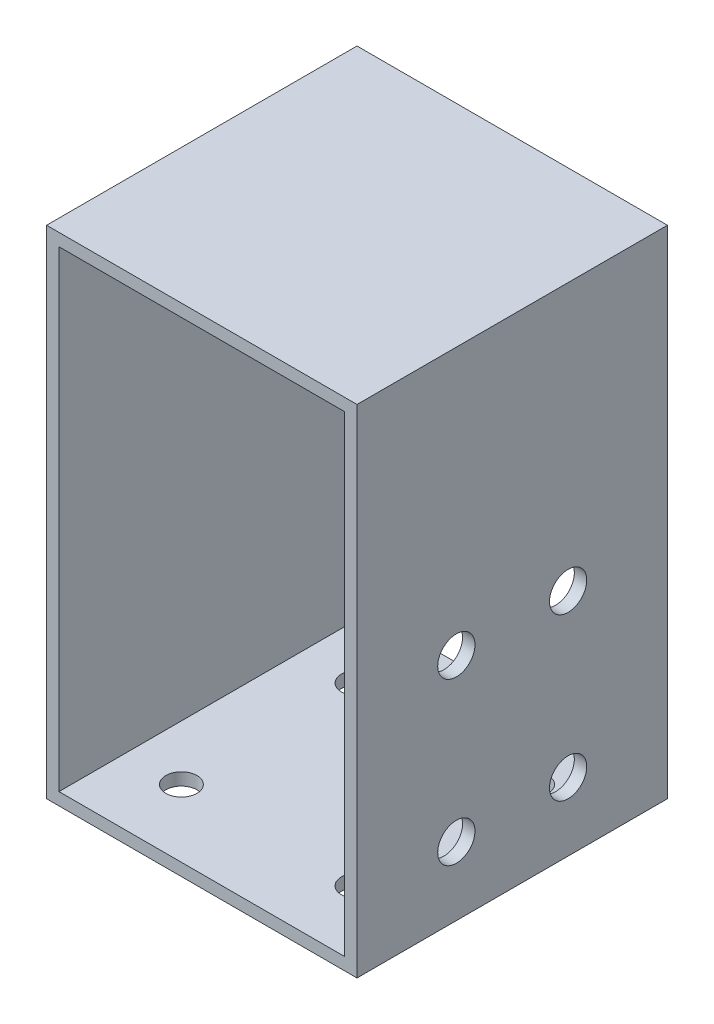
from build123d import *

# Parameters (mm, degrees)
SKETCH_1_W          = 25
SKETCH_1_H          = 40
SKETCH_1_W_2        = 23
SKETCH_1_H_2        = 38
EXTRUDE_1_DEPTH     = 12.5
SKETCH_2_R          = 1.25
CUT_EXTRUDE_1_DEPTH = 10
SKETCH_3_R          = 1.5
CUT_EXTRUDE_2_DEPTH = 10


with BuildPart() as part:
    # 草图1 → 凸台-拉伸1 (new, symmetric)
    with BuildSketch(Plane.XY):
        Rectangle(SKETCH_1_W, SKETCH_1_H)
        Rectangle(SKETCH_1_W_2, SKETCH_1_H_2, mode=Mode.SUBTRACT)
    extrude(amount=EXTRUDE_1_DEPTH, both=True)

    # 草图2 → 切除-拉伸1 (cut)
    with BuildSketch(Plane(origin=(0, -19, 0), x_dir=(1, 0, 0), z_dir=(0, 1, 0))):
        with Locations(Location((7.071067812, -7.071067812, 0), (0, 0, 270))):
            Circle(SKETCH_2_R)
        with Locations(Location((7.071067812, 7.071067812, 0), (0, 0, 270))):
            Circle(SKETCH_2_R)
        with Locations(Location((-7.071067812, 7.071067812, 0), (0, 0, 270))):
            Circle(SKETCH_2_R)
        with Locations(Location((-7.071067812, -7.071067812, 0), (0, 0, 270))):
            Circle(SKETCH_2_R)
    extrude(amount=-CUT_EXTRUDE_1_DEPTH, mode=Mode.SUBTRACT)

    # 草图3 → 切除-拉伸2 (cut)
    with BuildSketch(Plane.ZY.offset(-11.5)):
        with Locations((4.5, -14.5)):
            Circle(SKETCH_3_R)
        with Locations((-4.5, -14.5)):
            Circle(SKETCH_3_R)
        with Locations((-4.5, -1.5)):
            Circle(SKETCH_3_R)
        with Locations((4.5, -1.5)):
            Circle(SKETCH_3_R)
    extrude(amount=-CUT_EXTRUDE_2_DEPTH, mode=Mode.SUBTRACT)


solid = part.part
